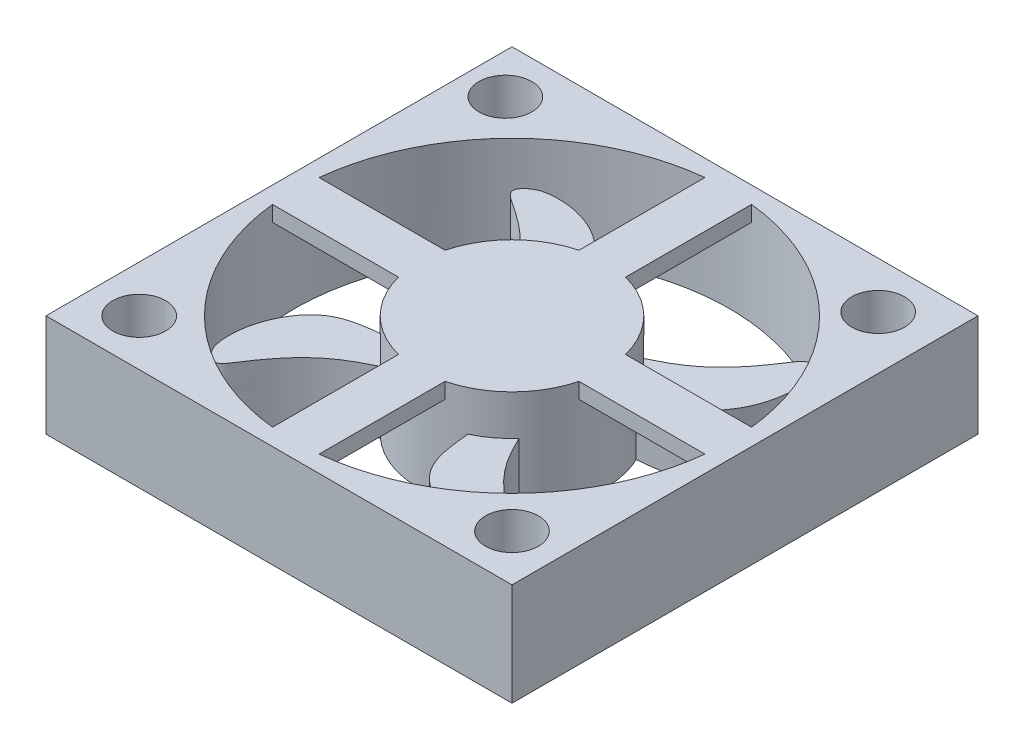
from build123d import *

# Parameters (mm, degrees)
SKETCH1_R             = 6
BOSS_EXTRUDE1_DEPTH   = 6.6
SKETCH1_W             = 30
SKETCH1_H             = 30
SKETCH1_R_2           = 14
BOSS_EXTRUDE1_2_DEPTH = 6.6
BOSS_EXTRUDE2_START   = -1
BOSS_EXTRUDE2_DEPTH   = 1
BOSS_EXTRUDE3_DEPTH   = 4
SKETCH4_R             = 1.7
CUT_EXTRUDE1_DEPTH    = 43.936697606


with BuildPart() as part:
    # Sketch1 → Boss-Extrude1 (new body)
    with BuildSketch(Plane(origin=(0, 0, 0), x_dir=(1, 0, 0), z_dir=(0, 1, 0))):
        with Locations(Location((15, 15, 0), (0, 0, 270))):
            Circle(SKETCH1_R)
    extrude(amount=BOSS_EXTRUDE1_DEPTH)



with BuildPart() as body_2:
    # Sketch1 → Boss-Extrude1 2 (new body)
    with BuildSketch(Plane(origin=(0, 0, 0), x_dir=(1, 0, 0), z_dir=(0, 1, 0))):
        with Locations((15, 15)):
            Rectangle(SKETCH1_W, SKETCH1_H)
        with Locations(Location((15, 15, 0), (0, 0, 270))):
            Circle(SKETCH1_R_2, mode=Mode.SUBTRACT)
    extrude(amount=BOSS_EXTRUDE1_2_DEPTH)


with BuildPart() as part_1:
    add(part.part)

    add(body_2.part)  # Boss-Extrude2 merges body 2
    # Sketch2 → Boss-Extrude2 (add)
    with BuildSketch(Plane(origin=(0, 6.6, 0), x_dir=(1, 0, 0), z_dir=(0, 1, 0)).offset(BOSS_EXTRUDE2_START)):
        with BuildLine():
            Line((13.5, 28.919410907), (13.5, 20.809475019))
            ThreePointArc((13.5, 20.809475019), (15, 21), (16.5, 20.809475019))
            Line((16.5, 20.809475019), (16.5, 28.919410907))
            ThreePointArc((16.5, 28.919410907), (15, 29), (13.5, 28.919410907))
        make_face()
        with BuildLine():
            Line((1.080589093, 16.5), (9.190524981, 16.5))
            ThreePointArc((9.190524981, 16.5), (9, 15), (9.190524981, 13.5))
            Line((9.190524981, 13.5), (1.080589093, 13.5))
            ThreePointArc((1.080589093, 13.5), (1, 15), (1.080589093, 16.5))
        make_face()
        with BuildLine():
            Line((16.5, 9.190524981), (16.5, 1.080589093))
            ThreePointArc((16.5, 1.080589093), (15, 1), (13.5, 1.080589093))
            Line((13.5, 1.080589093), (13.5, 9.190524981))
            ThreePointArc((13.5, 9.190524981), (15, 9), (16.5, 9.190524981))
        make_face()
        with BuildLine():
            Line((20.809475019, 16.5), (28.919410907, 16.5))
            ThreePointArc((28.919410907, 16.5), (29, 15), (28.919410907, 13.5))
            Line((28.919410907, 13.5), (20.809475019, 13.5))
            ThreePointArc((20.809475019, 13.5), (21, 15), (20.809475019, 16.5))
        make_face()
    extrude(amount=BOSS_EXTRUDE2_DEPTH)

    # Sketch3 → Boss-Extrude3 (add)
    with BuildSketch(Plane.XZ):
        with BuildLine():
            ThreePointArc((10.984580655, -10.541703522), (10.192273789, -11.410324711), (9.58456397, -12.416774767))
            add(Edge.make_bspline(
                [(9.58456397, -12.416774767), (8.410808732, -12.309363624), (5.380693334, -12.032075695), (4.103757472, -8.185431429), (4.56953199, -6.058287866), (5.387449297, -4.938364862), (7.834696959, -8.987085919), (9.507507968, -9.812697812), (10.984580655, -10.541703522)],
                knots=[0, 0, 0, 0, 0.170031564, 0.438946079, 0.451593931, 0.514549839, 0.557853027, 0.884625814, 0.884625814, 0.884625814, 0.884625814], degree=3))
        make_face()
        with BuildLine():
            ThreePointArc((19.458296478, -10.984580655), (18.589675289, -10.192273789), (17.583225233, -9.58456397))
            add(Edge.make_bspline(
                [(17.583225233, -9.58456397), (17.690636376, -8.410808732), (17.967924305, -5.380693334), (21.814568571, -4.103757472), (23.941712134, -4.56953199), (25.061635138, -5.387449297), (21.012914081, -7.834696959), (20.187302188, -9.507507968), (19.458296478, -10.984580655)],
                knots=[0, 0, 0, 0, 0.170031564, 0.438946079, 0.451593931, 0.514549839, 0.557853027, 0.884625814, 0.884625814, 0.884625814, 0.884625814], degree=3))
        make_face()
        with BuildLine():
            ThreePointArc((19.015419345, -19.458296478), (19.807726211, -18.589675289), (20.41543603, -17.583225233))
            add(Edge.make_bspline(
                [(20.41543603, -17.583225233), (21.589191268, -17.690636376), (24.619306666, -17.967924305), (25.896242528, -21.814568571), (25.43046801, -23.941712134), (24.612550703, -25.061635138), (22.165303041, -21.012914081), (20.492492032, -20.187302188), (19.015419345, -19.458296478)],
                knots=[0, 0, 0, 0, 0.170031564, 0.438946079, 0.451593931, 0.514549839, 0.557853027, 0.884625814, 0.884625814, 0.884625814, 0.884625814], degree=3))
        make_face()
        with BuildLine():
            ThreePointArc((10.541703522, -19.015419345), (11.410324711, -19.807726211), (12.416774767, -20.41543603))
            add(Edge.make_bspline(
                [(12.416774767, -20.41543603), (12.309363624, -21.589191268), (12.032075695, -24.619306666), (8.185431429, -25.896242528), (6.058287866, -25.43046801), (4.938364862, -24.612550703), (8.987085919, -22.165303041), (9.812697812, -20.492492032), (10.541703522, -19.015419345)],
                knots=[0, 0, 0, 0, 0.170031564, 0.438946079, 0.451593931, 0.514549839, 0.557853027, 0.884625814, 0.884625814, 0.884625814, 0.884625814], degree=3))
        make_face()
    extrude(amount=-BOSS_EXTRUDE3_DEPTH)

    # Sketch4 → Cut-Extrude1 (cut, through all)
    with BuildSketch(Plane(origin=(0, 6.6, 0), x_dir=(1, 0, 0), z_dir=(0, 1, 0))):
        with Locations(Location((2.571237946, 27, 0), (0, 0, 270))):
            Circle(SKETCH4_R)
        with Locations(Location((26.571237946, 27, 0), (0, 0, 270))):
            Circle(SKETCH4_R)
        with Locations(Location((27, 3, 0), (0, 0, 270))):
            Circle(SKETCH4_R)
        with Locations(Location((3, 3, 0), (0, 0, 270))):
            Circle(SKETCH4_R)
    extrude(amount=-CUT_EXTRUDE1_DEPTH, mode=Mode.SUBTRACT)


solid = part_1.part
